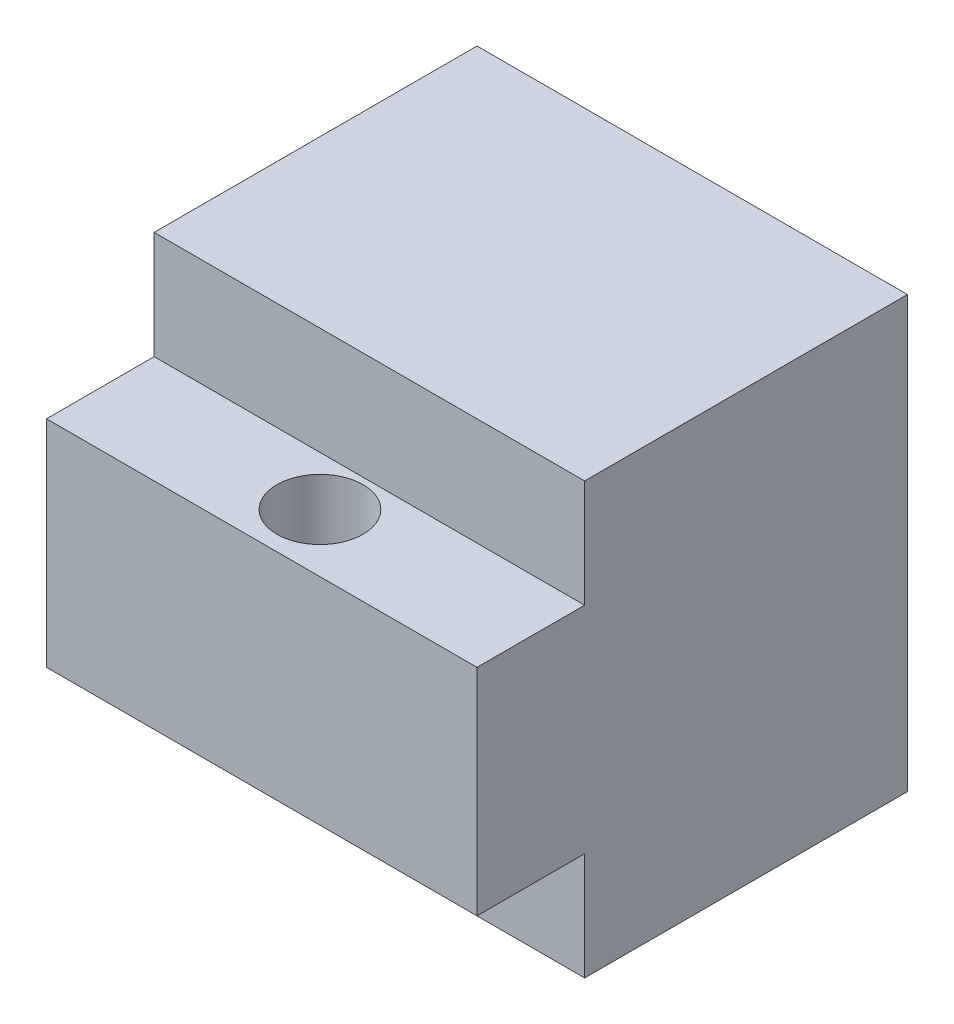
from build123d import *

# Parameters (mm, degrees)
BOSS_EXTRUDE1_DEPTH = 10
SKETCH3_R           = 1
CUT_EXTRUDE2_DEPTH  = 14.462912018


with BuildPart() as part:
    # Sketch1 → Boss-Extrude1 (new body)
    with BuildSketch(Plane(origin=(0, 0, 0), x_dir=(0, 0, -1), z_dir=(1, 0, 0))):
        Polygon((-2.5, 5), (5, 5), (5, -5), (-2.5, -5), (-2.5, -2.5), (-5, -2.5), (-5, 2.5), (-2.5, 2.5), align=None)
    extrude(amount=BOSS_EXTRUDE1_DEPTH)

    # Sketch3 → Cut-Extrude2 (cut, through all)
    with BuildSketch(Plane(origin=(0, 2.5, 0), x_dir=(1, 0, 0), z_dir=(0, 1, 0))):
        with Locations(Location((5, -3.647879646, 0), (0, 0, 270))):
            Circle(SKETCH3_R)
    extrude(amount=-CUT_EXTRUDE2_DEPTH, mode=Mode.SUBTRACT)


solid = part.part
